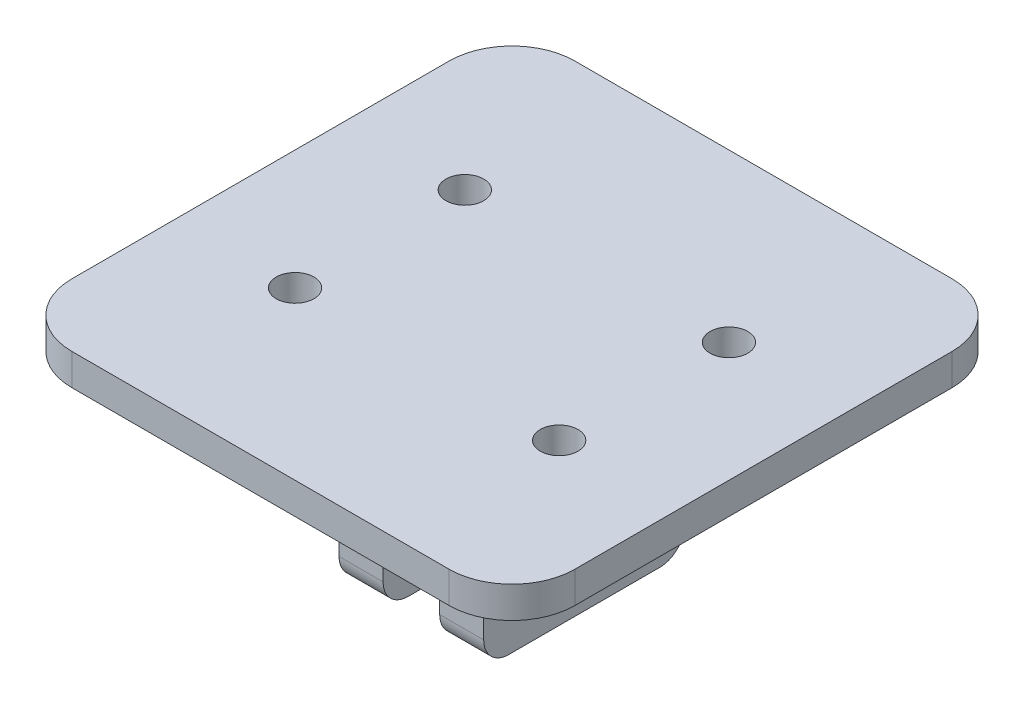
from build123d import *

# Parameters (mm, degrees)
SKETCH1_R               = 1.5
BOSS_EXTRUDE1_DEPTH     = 2.5
SKETCH2_W               = 3.5
SKETCH2_H               = 16
BOSS_EXTRUDE2_DEPTH     = 15
FILLET1_R               = 2
CUT_EXTRUDE1_DEPTH      = 36.889587626
CUT_EXTRUDE1_DEPTH_BACK = 36.889587626
SKETCH3_R               = 3


with BuildPart() as part:
    # Sketch1 → Boss-Extrude1 (new body)
    with BuildSketch(Plane(origin=(0, 0, 0), x_dir=(1, 0, 0), z_dir=(0, 1, 0))):
        with BuildLine():
            Line((15, 20), (-15, 20))
            ThreePointArc((-15, 20), (-18.535533906, 18.535533906), (-20, 15))
            Line((-20, 15), (-20, -15))
            ThreePointArc((-20, -15), (-18.535533906, -18.535533906), (-15, -20))
            Line((-15, -20), (15, -20))
            ThreePointArc((15, -20), (18.535533906, -18.535533906), (20, -15))
            Line((20, -15), (20, 15))
            ThreePointArc((20, 15), (18.535533906, 18.535533906), (15, 20))
        make_face()
        with Locations(Location((10.5, -6.75, 0), (0, 0, 270))):
            Circle(SKETCH1_R, mode=Mode.SUBTRACT)
        with Locations(Location((-10.5, -6.75, 0), (0, 0, 270))):
            Circle(SKETCH1_R, mode=Mode.SUBTRACT)
        with Locations(Location((-10.5, 6.75, 0), (0, 0, 270))):
            Circle(SKETCH1_R, mode=Mode.SUBTRACT)
        with Locations(Location((10.5, 6.75, 0), (0, 0, 270))):
            Circle(SKETCH1_R, mode=Mode.SUBTRACT)
    extrude(amount=BOSS_EXTRUDE1_DEPTH)

    # Sketch2 → Boss-Extrude2 (add)
    with BuildSketch(Plane.XZ):
        with Locations((-4, 0)):
            Rectangle(SKETCH2_W, SKETCH2_H)
        with Locations((4, 0)):
            Rectangle(SKETCH2_W, SKETCH2_H)
    extrude(amount=BOSS_EXTRUDE2_DEPTH)

    # Fillet1
    fillet1_edges = [part.edges().sort_by_distance(p)[0] for p in [
        (-4, -15, -8),
        (-4, -15, 8),
        (4, -15, -8),
        (4, -15, 8),
    ]]
    fillet(fillet1_edges, radius=FILLET1_R)

    # Sketch3 → Cut-Extrude1 (cut, two sides: drawn at the far end of the back side and taken through both)
    with BuildSketch(Plane.ZY.offset(5.75).offset(-CUT_EXTRUDE1_DEPTH_BACK)):
        with Locations((0, -10)):
            Circle(SKETCH3_R)
    extrude(amount=CUT_EXTRUDE1_DEPTH + CUT_EXTRUDE1_DEPTH_BACK, mode=Mode.SUBTRACT)


solid = part.part
